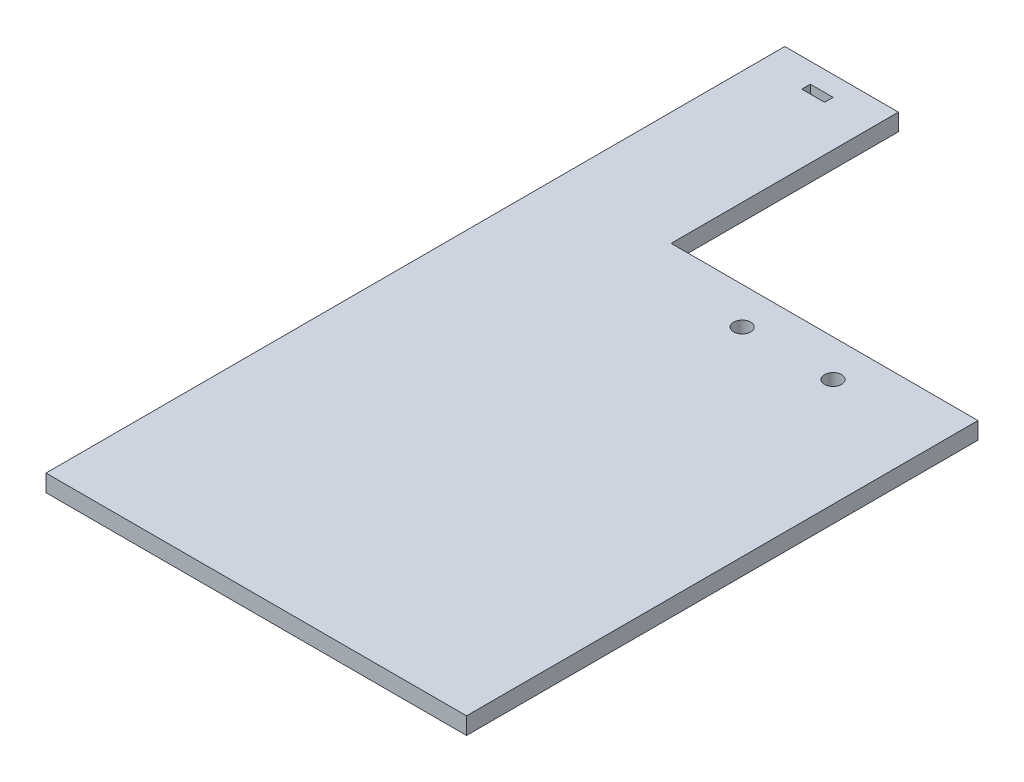
from build123d import *

# Parameters (mm, degrees)
SKETCH1_W           = 4
SKETCH1_H           = 1.5
BOSS_EXTRUDE1_DEPTH = 3
SKETCH4_W           = 15
SKETCH4_H           = 3
CUT_EXTRUDE3_DEPTH  = 158.575378787
SKETCH7_R           = 1.5
CUT_EXTRUDE6_DEPTH  = 10


with BuildPart() as part:
    # Sketch1 → Boss-Extrude1 (new body)
    with BuildSketch(Plane(origin=(0, 0, 0), x_dir=(1, 0, 0), z_dir=(0, 1, 0))):
        Polygon((0, 90), (0, 130), (20, 130), (20, 90), (89, 90), (89, 0), (0, 0), align=None)
        with Locations((10, 125.75)):
            Rectangle(SKETCH1_W, SKETCH1_H, mode=Mode.SUBTRACT)
    extrude(amount=BOSS_EXTRUDE1_DEPTH)

    # Sketch4 → Cut-Extrude3 (cut, through all)
    with BuildSketch(Plane.XY):
        with Locations((81.5, 1.5)):
            Rectangle(SKETCH4_W, SKETCH4_H)
    extrude(amount=-CUT_EXTRUDE3_DEPTH, mode=Mode.SUBTRACT)

    # Sketch7 → Cut-Extrude6 (cut)
    with BuildSketch(Plane(origin=(0, 3, 0), x_dir=(1, 0, 0), z_dir=(0, 1, 0))):
        with Locations(Location((39, 83.5, 0), (0, 0, 270))):
            Circle(SKETCH7_R)
        with Locations(Location((55, 83.5, 0), (0, 0, 270))):
            Circle(SKETCH7_R)
    extrude(amount=-CUT_EXTRUDE6_DEPTH, mode=Mode.SUBTRACT)


solid = part.part
